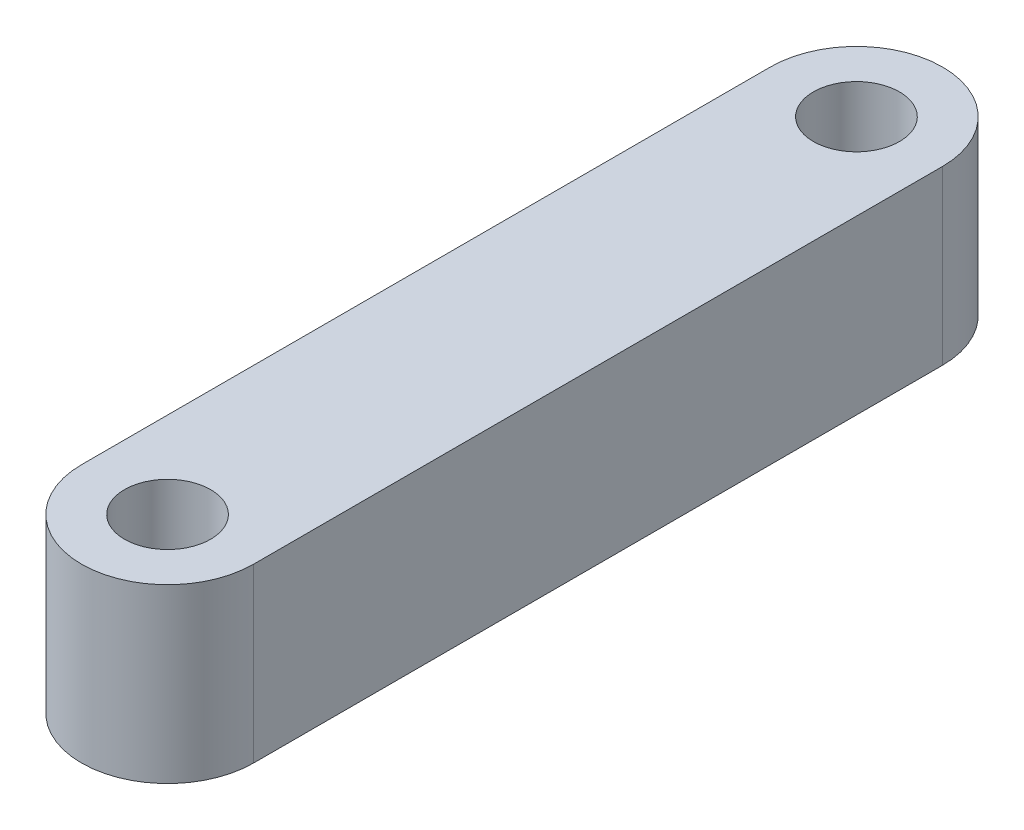
from build123d import *

# Parameters (mm, degrees)
SKETCH1_R           = 1.5875
BOSS_EXTRUDE1_DEPTH = 6.35


with BuildPart() as part:
    # Sketch1 → Boss-Extrude1 (new body)
    with BuildSketch(Plane(origin=(0, 0, 0), x_dir=(1, 0, 0), z_dir=(0, 1, 0))):
        with BuildLine():
            Line((-3.175, 25.399999799), (-3.175, 2.01e-07))
            ThreePointArc((-3.175, 2.01e-07), (0, -3.175), (3.175, 2.01e-07))
            Line((3.175, 2.01e-07), (3.175, 25.399999799))
            ThreePointArc((3.175, 25.399999799), (0, 28.575), (-3.175, 25.399999799))
        make_face()
        with Locations(Location((0, 0, 0), (0, 0, 270))):
            Circle(SKETCH1_R, mode=Mode.SUBTRACT)
        with Locations(Location((0, 25.4, 0), (0, 0, 270))):
            Circle(SKETCH1_R, mode=Mode.SUBTRACT)
    extrude(amount=BOSS_EXTRUDE1_DEPTH)


solid = part.part
